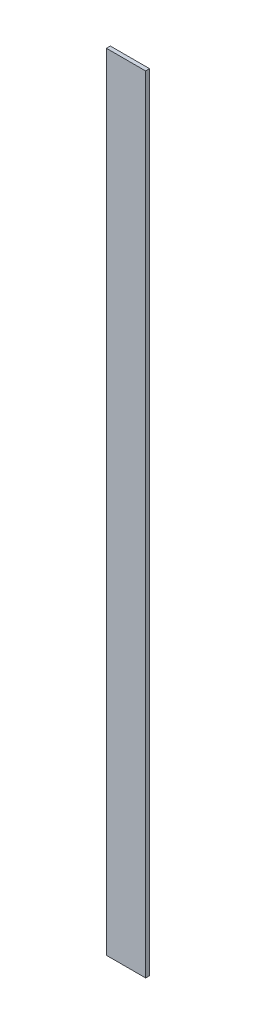
from build123d import *

# Parameters (mm, degrees)
SKETCH1_W     = 60
SKETCH1_H     = 1200
PROFILE_DEPTH = 6


with BuildPart() as part:
    # Sketch1 → Profile (new body)
    with BuildSketch(Plane.XY):
        with Locations((30, 600)):
            Rectangle(SKETCH1_W, SKETCH1_H)
    extrude(amount=PROFILE_DEPTH)


solid = part.part
